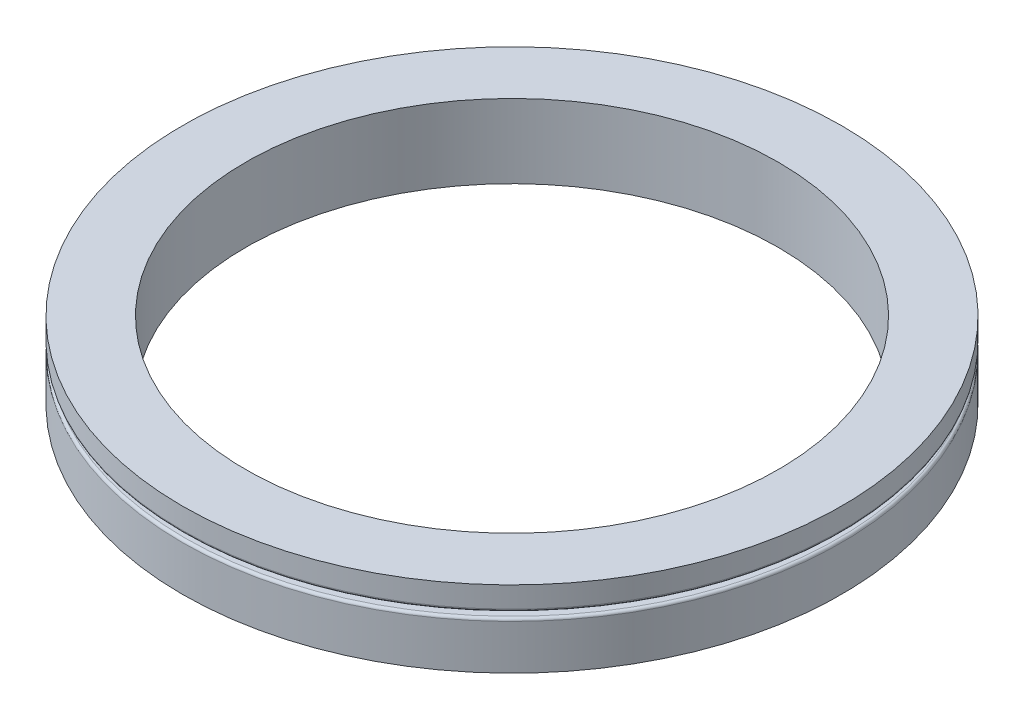
from build123d import *


with BuildPart() as part:
    # Sketch3<3> (on Front Plane) → Revolve2 (revolve)
    with BuildSketch(Plane.XY, mode=Mode.PRIVATE) as revolve2_sk:
        with BuildLine():
            Line((-119.899137803, -11), (-124, -11))
            ThreePointArc((-124, -11), (-124.707106781, -11.292893219), (-125, -12))
            Line((-125, -12), (-125, -29))
            Line((-125, -29), (-114.05, -29))
            Line((-114.05, -29), (-114.05, -20.150862197))
            Line((-114.05, -20.150862197), (-112, -18.100862197))
            Line((-112, -18.100862197), (-112, -14.05))
            ThreePointArc((-112, -14.05), (-112.292893219, -13.342893219), (-113, -13.05))
            Line((-113, -13.05), (-117.849137803, -13.05))
            Line((-117.849137803, -13.05), (-119.899137803, -11))
        make_face()
    revolve(revolve2_sk.sketch.rotate(Axis((0, 0, 0), (0, 1, 0)), 270), axis=Axis((0, 0, 0), (0, 1, 0)))


with BuildPart() as body_2:
    # Sketch3<5> (on Front Plane) → Revolve4 (revolve)
    with BuildSketch(Plane.XY, mode=Mode.PRIVATE) as revolve4_sk:
        with BuildLine():
            ThreePointArc((-117, -9.25), (-115.383210818, -11.669696007), (-118.237436867, -12.237436867))
            Line((-118.237436867, -12.237436867), (-119.774873734, -10.7))
            Line((-119.774873734, -10.7), (-121.774873734, -10.7))
            Line((-121.774873734, -10.7), (-121.774873734, -9.25))
            Line((-121.774873734, -9.25), (-117, -9.25))
        make_face()
    revolve(revolve4_sk.sketch.rotate(Axis((0, 0, 0), (0, 1, 0)), 270), axis=Axis((0, 0, 0), (0, 1, 0)))


with BuildPart() as body_3:
    # Sketch3 again (on Front Plane) → Revolve5 (revolve)
    with BuildSketch(Plane.XY, mode=Mode.PRIVATE) as revolve5_sk:
        with BuildLine():
            Line((-113.75, -25.774873734), (-113.75, -21))
            ThreePointArc((-113.75, -21), (-111.330303993, -19.383210818), (-110.762563133, -22.237436867))
            Line((-110.762563133, -22.237436867), (-112.3, -23.774873734))
            Line((-112.3, -23.774873734), (-112.3, -25.774873734))
            Line((-112.3, -25.774873734), (-113.75, -25.774873734))
        make_face()
    revolve(revolve5_sk.sketch.rotate(Axis((0, 0, 0), (0, 1, 0)), 270), axis=Axis((0, 0, 0), (0, 1, 0)))


with BuildPart() as body_4:
    # Sketch3<7> (on Front Plane) → Revolve6 (revolve)
    with BuildSketch(Plane.XY, mode=Mode.PRIVATE) as revolve6_sk:
        with BuildLine():
            ThreePointArc((-125, -7.95), (-124.707106781, -8.657106781), (-124, -8.95))
            Line((-124, -8.95), (-121.774873734, -8.95))
            Line((-121.774873734, -8.95), (-116.150862197, -8.95))
            Line((-116.150862197, -8.95), (-114.100862197, -11))
            Line((-114.100862197, -11), (-110.95, -11))
            ThreePointArc((-110.95, -11), (-110.242893219, -11.292893219), (-109.95, -12))
            Line((-109.95, -12), (-109.95, -16.924568901))
            Line((-109.95, -16.924568901), (-101, -16.924568901))
            Line((-101, -16.924568901), (-101, 0))
            Line((-101, 0), (-125, 0))
            Line((-125, 0), (-125, -7.95))
        make_face()
    revolve(revolve6_sk.sketch.rotate(Axis((0, 0, 0), (0, 1, 0)), 270), axis=Axis((0, 0, 0), (0, 1, 0)))

    # Sketch3<8> (on Front Plane) → Revolve7 (revolve)
    with BuildSketch(Plane.XY, mode=Mode.PRIVATE) as revolve7_sk:
        with BuildLine():
            Line((-112, -23.899137803), (-112, -27))
            ThreePointArc((-112, -27), (-111.707106781, -27.707106781), (-111, -28))
            Line((-111, -28), (-101, -28))
            Line((-101, -28), (-101, -16.924568901))
            Line((-101, -16.924568901), (-109.95, -16.924568901))
            Line((-109.95, -16.924568901), (-109.95, -21.849137803))
            Line((-109.95, -21.849137803), (-112, -23.899137803))
        make_face()
    revolve(revolve7_sk.sketch.rotate(Axis((0, 0, 0), (0, 1, 0)), 270), axis=Axis((0, 0, 0), (0, 1, 0)))


solid = Compound([part.part, body_2.part, body_3.part, body_4.part])
